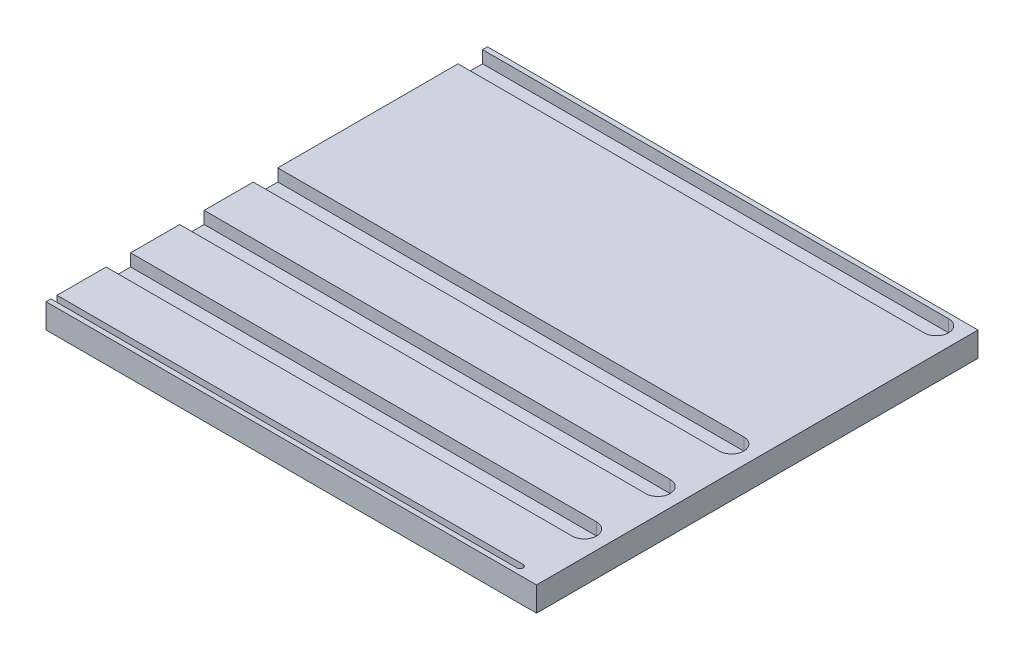
from build123d import *

# Parameters (mm, degrees)
SKETCH1_W           = 127
SKETCH1_H           = 114.3
BOSS_EXTRUDE1_DEPTH = 6.35
SKETCH2_W           = 120.65
SKETCH2_H           = 6.35
SKETCH2_H_2         = 1.5875
CUT_EXTRUDE1_DEPTH  = 3.175


with BuildPart() as part:
    # Sketch1 → Boss-Extrude1 (new body)
    with BuildSketch(Plane(origin=(0, 0, 0), x_dir=(1, 0, 0), z_dir=(0, 1, 0))):
        with Locations((63.5, 57.15)):
            Rectangle(SKETCH1_W, SKETCH1_H)
    extrude(amount=-BOSS_EXTRUDE1_DEPTH)

    # Sketch2 → Cut-Extrude1 (cut)
    with BuildSketch(Plane(origin=(0, 0, 0), x_dir=(1, 0, 0), z_dir=(0, 1, 0))):
        with Locations((60.325, 109.855)):
            Rectangle(SKETCH2_W, SKETCH2_H)
        with BuildLine():
            Line((120.65, 106.68), (120.65, 113.03))
            ThreePointArc((120.65, 113.03), (123.825, 109.855), (120.65, 106.68))
        make_face()
        with Locations((60.325, 56.8325)):
            Rectangle(SKETCH2_W, SKETCH2_H)
        with Locations((60.325, 37.7825)):
            Rectangle(SKETCH2_W, SKETCH2_H)
        with Locations((60.325, 18.7325)):
            Rectangle(SKETCH2_W, SKETCH2_H)
        with Locations((60.325, 2.06375)):
            Rectangle(SKETCH2_W, SKETCH2_H_2)
        with BuildLine():
            Line((120.65, 1.27), (120.65, 2.8575))
            ThreePointArc((120.65, 2.8575), (121.44375, 2.06375), (120.65, 1.27))
        make_face()
        with BuildLine():
            Line((120.65, 15.5575), (120.65, 21.9075))
            ThreePointArc((120.65, 21.9075), (123.825, 18.7325), (120.65, 15.5575))
        make_face()
        with BuildLine():
            Line((120.65, 34.6075), (120.65, 40.9575))
            ThreePointArc((120.65, 40.9575), (123.825, 37.7825), (120.65, 34.6075))
        make_face()
        with BuildLine():
            Line((120.65, 53.6575), (120.65, 60.0075))
            ThreePointArc((120.65, 60.0075), (123.825, 56.8325), (120.65, 53.6575))
        make_face()
    extrude(amount=-CUT_EXTRUDE1_DEPTH, mode=Mode.SUBTRACT)


solid = part.part
